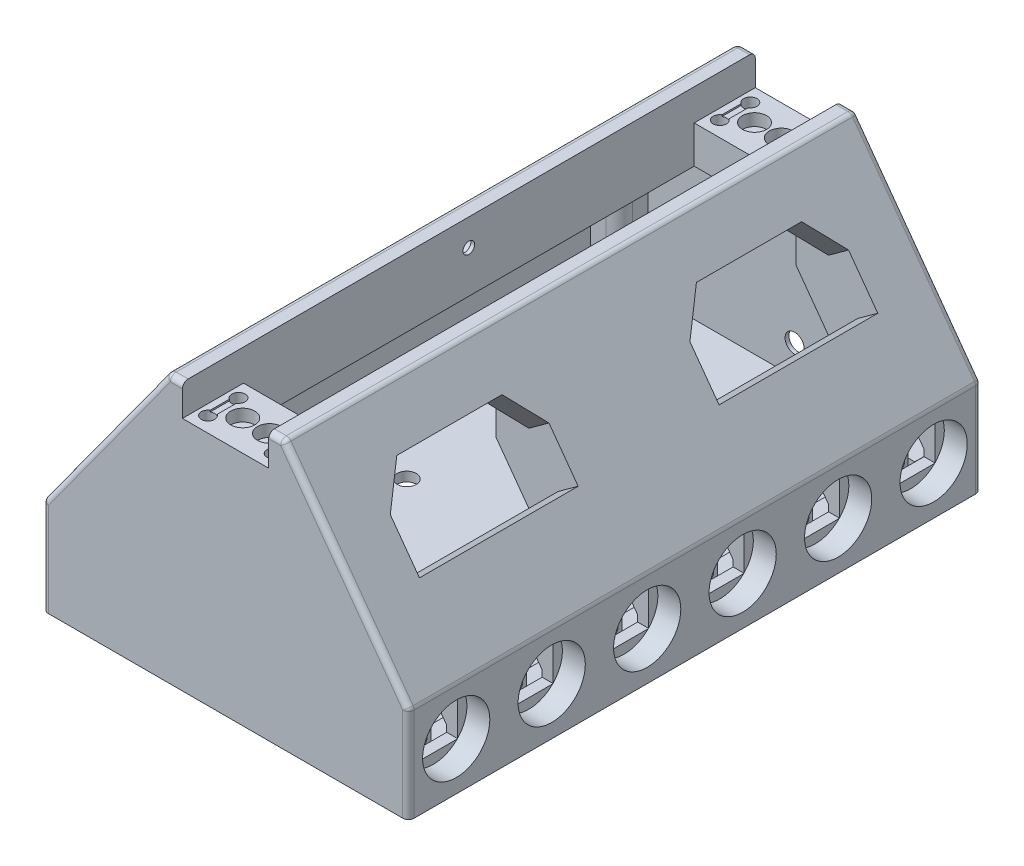
from build123d import *

# Parameters (mm, degrees)
BOSS_EXTRUDE2_DEPTH  = 150
CUT_EXTRUDE1_REACH   = 171.154
SKETCH3_R            = 1.75
SKETCH3_W            = 22.6
SKETCH3_H            = 118
BOSS_EXTRUDE4_DEPTH  = 150
SKETCH5_R            = 1.52
CUT_EXTRUDE2_DEPTH   = 176.795274739
CUT_EXTRUDE3_START   = 26.6
SKETCH6_R            = 1.52
CUT_EXTRUDE3_DEPTH   = 26.6
SKETCH7_R            = 2.8
CUT_EXTRUDE4_DEPTH   = 177.134515209
CUT_EXTRUDE5_REACH   = 181.704
SKETCH10_W           = 15.7
SKETCH10_H           = 29.5
CUT_EXTRUDE6_REACH   = 181.704
SKETCH11_W           = 41.55
SKETCH11_H           = 22
SKETCH13_W           = 10.694631307
SKETCH13_H           = 41.55
CUT_EXTRUDE7_DEPTH   = 12
SKETCH14_W           = 6.5
SKETCH14_H           = 7
BOSS_EXTRUDE5_DEPTH  = 9
SKETCH18_R           = 8.8
CUT_EXTRUDE8_DEPTH   = 6
CUT_EXTRUDE9_REACH   = 181.704
BOSS_EXTRUDE6_DEPTH  = 1
BOSS_EXTRUDE7_REACH  = 173.516
SKETCH27_R           = 2
CUT_EXTRUDE13_DEPTH  = 172.516398252
SKETCH29_R           = 2
CUT_EXTRUDE14_DEPTH  = 172.516398252
CUT_EXTRUDE_START    = -2.5
CUT_EXTRUDE_D_DEPTH  = 2.5
BOSS_EXTRUDE8_DEPTH  = 1.4
SKETCH33_R           = 2.5
CUT_EXTRUDE16_DEPTH  = 172.449336159
FILLET1_R            = 1.5
SKETCH34_R           = 3.15
CUT_EXTRUDE17_DEPTH  = 3.15
CUT_EXTRUDE18_REACH  = 190.314
SKETCH35_W           = 12.8
SKETCH35_H           = 12.35
SKETCH38_W           = 4.5
SKETCH38_H           = 14.045
BOSS_EXTRUDE10_DEPTH = 5
SKETCH39_R           = 1.25
CUT_EXTRUDE19_DEPTH  = 1.5
LPATTERN1_COUNT      = 6
LPATTERN1_PITCH      = 25
CUT_EXTRUDE20_DEPTH  = 0.4
BOSS_EXTRUDE12_START = 0.3
BOSS_EXTRUDE12_DEPTH = 5.5
BOSS_EXTRUDE13_DEPTH = 2.45
CUT_EXTRUDE22_START  = 0.05
SKETCH44_R           = 1.58
CUT_EXTRUDE22_DEPTH  = 2.45
SKETCH45_R           = 2.5
CUT_EXTRUDE23_DEPTH  = 2.45
BOSS_EXTRUDE14_DEPTH = 3.5


with BuildPart() as part:
    # Sketch1 → Boss-Extrude2 (new body)
    with BuildSketch(Plane.XY):
        Polygon((47.89441376, 0), (-47.89441376, 0), (-47.89441376, 25), (-15.2, 70), (-11.3, 70), (-11.3, 61.8), (11.3, 61.8), (11.3, 70), (15.2, 70), (47.89441376, 25), align=None)
        Polygon((45.89441376, 2), (-45.89441376, 2), (-45.89441376, 23.499509799), (-25.183315487, 52.005891016), (25.183315487, 52.005891016), (45.89441376, 23.499509799), align=None, mode=Mode.SUBTRACT)
    extrude(amount=BOSS_EXTRUDE2_DEPTH)

    # Sketch3 → Cut-Extrude1 (cut, up to next)
    with BuildSketch(Plane(origin=(0, 61.8, 0), x_dir=(1, 0, 0), z_dir=(0, 1, 0)), mode=Mode.PRIVATE) as cut_extrude1_sk1:
        with Locations(Location((-8.6, -12, 0), (0, 0, 270))):
            Circle(SKETCH3_R)
    cut_extrude1_tool1 = extrude(cut_extrude1_sk1.sketch, amount=-CUT_EXTRUDE1_REACH, mode=Mode.PRIVATE) & part.part
    # Sketch3 → Cut-Extrude1 (cut, up to next)
    with BuildSketch(Plane(origin=(0, 61.8, 0), x_dir=(1, 0, 0), z_dir=(0, 1, 0)), mode=Mode.PRIVATE) as cut_extrude1_sk2:
        with Locations(Location((-8.6, -4, 0), (0, 0, 270))):
            Circle(SKETCH3_R)
    cut_extrude1_tool2 = extrude(cut_extrude1_sk2.sketch, amount=-CUT_EXTRUDE1_REACH, mode=Mode.PRIVATE) & part.part
    # Sketch3 → Cut-Extrude1 (cut, up to next)
    with BuildSketch(Plane(origin=(0, 61.8, 0), x_dir=(1, 0, 0), z_dir=(0, 1, 0)), mode=Mode.PRIVATE) as cut_extrude1_sk3:
        with Locations(Location((8.6, -12, 0), (0, 0, 270))):
            Circle(SKETCH3_R)
    cut_extrude1_tool3 = extrude(cut_extrude1_sk3.sketch, amount=-CUT_EXTRUDE1_REACH, mode=Mode.PRIVATE) & part.part
    # Sketch3 → Cut-Extrude1 (cut, up to next)
    with BuildSketch(Plane(origin=(0, 61.8, 0), x_dir=(1, 0, 0), z_dir=(0, 1, 0)), mode=Mode.PRIVATE) as cut_extrude1_sk4:
        with Locations(Location((8.6, -4, 0), (0, 0, 270))):
            Circle(SKETCH3_R)
    cut_extrude1_tool4 = extrude(cut_extrude1_sk4.sketch, amount=-CUT_EXTRUDE1_REACH, mode=Mode.PRIVATE) & part.part
    # Sketch3 → Cut-Extrude1 (cut, up to next)
    with BuildSketch(Plane(origin=(0, 61.8, 0), x_dir=(1, 0, 0), z_dir=(0, 1, 0)), mode=Mode.PRIVATE) as cut_extrude1_sk5:
        with Locations(Location((8.6, -138, 0), (0, 0, 270))):
            Circle(SKETCH3_R)
    cut_extrude1_tool5 = extrude(cut_extrude1_sk5.sketch, amount=-CUT_EXTRUDE1_REACH, mode=Mode.PRIVATE) & part.part
    # Sketch3 → Cut-Extrude1 (cut, up to next)
    with BuildSketch(Plane(origin=(0, 61.8, 0), x_dir=(1, 0, 0), z_dir=(0, 1, 0)), mode=Mode.PRIVATE) as cut_extrude1_sk6:
        with Locations(Location((8.6, -146, 0), (0, 0, 270))):
            Circle(SKETCH3_R)
    cut_extrude1_tool6 = extrude(cut_extrude1_sk6.sketch, amount=-CUT_EXTRUDE1_REACH, mode=Mode.PRIVATE) & part.part
    # Sketch3 → Cut-Extrude1 (cut, up to next)
    with BuildSketch(Plane(origin=(0, 61.8, 0), x_dir=(1, 0, 0), z_dir=(0, 1, 0)), mode=Mode.PRIVATE) as cut_extrude1_sk7:
        with Locations(Location((-8.6, -146, 0), (0, 0, 270))):
            Circle(SKETCH3_R)
    cut_extrude1_tool7 = extrude(cut_extrude1_sk7.sketch, amount=-CUT_EXTRUDE1_REACH, mode=Mode.PRIVATE) & part.part
    # Sketch3 → Cut-Extrude1 (cut, up to next)
    with BuildSketch(Plane(origin=(0, 61.8, 0), x_dir=(1, 0, 0), z_dir=(0, 1, 0)), mode=Mode.PRIVATE) as cut_extrude1_sk8:
        with Locations(Location((-8.6, -138, 0), (0, 0, 270))):
            Circle(SKETCH3_R)
    cut_extrude1_tool8 = extrude(cut_extrude1_sk8.sketch, amount=-CUT_EXTRUDE1_REACH, mode=Mode.PRIVATE) & part.part
    # Sketch3 → Cut-Extrude1 (cut, up to next)
    with BuildSketch(Plane(origin=(0, 61.8, 0), x_dir=(1, 0, 0), z_dir=(0, 1, 0)), mode=Mode.PRIVATE) as cut_extrude1_sk9:
        with Locations((0, -75)):
            Rectangle(SKETCH3_W, SKETCH3_H)
    cut_extrude1_tool9 = extrude(cut_extrude1_sk9.sketch, amount=-CUT_EXTRUDE1_REACH, mode=Mode.PRIVATE) & part.part
    add(cut_extrude1_tool1.solids().sort_by_distance((-8.6, 61.8, 12))[0], mode=Mode.SUBTRACT)
    add(cut_extrude1_tool2.solids().sort_by_distance((-8.6, 61.8, 4))[0], mode=Mode.SUBTRACT)
    add(cut_extrude1_tool3.solids().sort_by_distance((8.6, 61.8, 12))[0], mode=Mode.SUBTRACT)
    add(cut_extrude1_tool4.solids().sort_by_distance((8.6, 61.8, 4))[0], mode=Mode.SUBTRACT)
    add(cut_extrude1_tool5.solids().sort_by_distance((8.6, 61.8, 138))[0], mode=Mode.SUBTRACT)
    add(cut_extrude1_tool6.solids().sort_by_distance((8.6, 61.8, 146))[0], mode=Mode.SUBTRACT)
    add(cut_extrude1_tool7.solids().sort_by_distance((-8.6, 61.8, 146))[0], mode=Mode.SUBTRACT)
    add(cut_extrude1_tool8.solids().sort_by_distance((-8.6, 61.8, 138))[0], mode=Mode.SUBTRACT)
    add(cut_extrude1_tool9.solids().sort_by_distance((0, 61.8, 75))[0], mode=Mode.SUBTRACT)

    # Sketch12 → Boss-Extrude4 (add)
    with BuildSketch(Plane(origin=(0, 0, 0), x_dir=(-1, 0, 0), z_dir=(0, 0, -1))):
        Polygon((-38.991903592, 8), (-14.3, 41.985489687), (-14.3, 52.005891016), (-25.183315487, 52.005891016), (-45.89441376, 23.499509799), (-45.89441376, 2), (-38.991903592, 2), align=None)
    extrude(amount=-BOSS_EXTRUDE4_DEPTH)

    # Sketch5 → Cut-Extrude2 (cut, through all)
    with BuildSketch(Plane(origin=(-11.3, 0, 0), x_dir=(0, 0, -1), z_dir=(1, 0, 0))):
        with Locations(Location((-75, 63, 0), (0, 0, 90))):
            Circle(SKETCH5_R)
    extrude(amount=-CUT_EXTRUDE2_DEPTH, mode=Mode.SUBTRACT)

    # Sketch6 → Cut-Extrude3 (cut)
    with BuildSketch(Plane(origin=(-11.3, 0, 0), x_dir=(0, 0, -1), z_dir=(1, 0, 0)).offset(CUT_EXTRUDE3_START)):
        with Locations(Location((-75, 63, 0), (0, 0, 90))):
            Circle(SKETCH6_R)
    extrude(amount=-CUT_EXTRUDE3_DEPTH, mode=Mode.SUBTRACT)

    # Sketch7 → Cut-Extrude4 (cut, through all)
    with BuildSketch(Plane(origin=(-12.3, 0, 0), x_dir=(0, 0, -1), z_dir=(1, 0, 0))):
        with Locations(Location((-75, 63, 0), (0, 0, 90))):
            Circle(SKETCH7_R)
    extrude(amount=-CUT_EXTRUDE4_DEPTH, mode=Mode.SUBTRACT)

    # Sketch10 → Cut-Extrude5 (cut, up to next)
    with BuildSketch(Plane(origin=(-43.235507228, 31.412434721, 0), x_dir=(0, 0, 1), z_dir=(-0.8090169943749446, 0.5877852522924771, 0)), mode=Mode.PRIVATE) as cut_extrude5_sk1:
        with Locations((75, 17.946853771)):
            Rectangle(SKETCH10_W, SKETCH10_H)
    cut_extrude5_tool1 = extrude(cut_extrude5_sk1.sketch, amount=-CUT_EXTRUDE5_REACH, mode=Mode.PRIVATE) & part.part
    add(cut_extrude5_tool1.solids().sort_by_distance((-32.686611, 45.931744, 75))[0], mode=Mode.SUBTRACT)

    # Sketch11 → Cut-Extrude6 (cut, up to next)
    with BuildSketch(Plane(origin=(43.235507228, 31.412434721, 0), x_dir=(0, 0, -1), z_dir=(0.8090169943749446, 0.5877852522924771, 0)), mode=Mode.PRIVATE) as cut_extrude6_sk1:
        with Locations((-114.225, 23.696853771)):
            Rectangle(SKETCH11_W, SKETCH11_H)
    cut_extrude6_tool1 = extrude(cut_extrude6_sk1.sketch, amount=-CUT_EXTRUDE6_REACH, mode=Mode.PRIVATE) & part.part
    cut_extrude6 = cut_extrude6_tool1.solids().sort_by_distance((29.306846, 50.583592, 114.225))[0]
    add(cut_extrude6, mode=Mode.SUBTRACT)

    # Sketch13 → Cut-Extrude7 (cut)
    with BuildSketch(Plane(origin=(-7.463023397, 10.271970476, 0), x_dir=(0.8090169943749446, 0.587785252292477, 0), z_dir=(-0.587785252292477, 0.8090169943749446, 0))):
        with Locations((41.594710322, -114.225)):
            Rectangle(SKETCH13_W, SKETCH13_H)
    cut_extrude7 = extrude(amount=-CUT_EXTRUDE7_DEPTH, mode=Mode.SUBTRACT)

    # Sketch14 → Boss-Extrude5 (add)
    with BuildSketch(Plane(origin=(-20.394298948, 28.070344352, 0), x_dir=(0.8090169943749446, 0.587785252292477, 0), z_dir=(0.587785252292477, -0.8090169943749446, 0))):
        with Locations((50.192025975, 96.95)):
            Rectangle(SKETCH14_W, SKETCH14_H)
        with Locations((50.192025975, 131.5)):
            Rectangle(SKETCH14_W, SKETCH14_H)
    boss_extrude5 = extrude(amount=BOSS_EXTRUDE5_DEPTH)

    # Sketch18 → Cut-Extrude8 (cut)
    with BuildSketch(Plane(origin=(47.89441376, 0, 0), x_dir=(0, 0, -1), z_dir=(1, 0, 0))):
        with Locations((-137.5, 12.5)):
            Circle(SKETCH18_R)
    cut_extrude8 = extrude(amount=-CUT_EXTRUDE8_DEPTH, mode=Mode.SUBTRACT)

    # Sketch19 → Cut-Extrude9 (cut, up to next)
    with BuildSketch(Plane(origin=(43.235507228, 31.412434721, 0), x_dir=(0, 0, -1), z_dir=(0.8090169943749448, 0.5877852522924768, 0)), mode=Mode.PRIVATE) as cut_extrude9_sk1:
        Polygon((-135, 25.696853771), (-128, 34.696853771), (-128, 25.696853771), align=None)
    cut_extrude9_tool1 = extrude(cut_extrude9_sk1.sketch, amount=-CUT_EXTRUDE9_REACH, mode=Mode.PRIVATE) & part.part
    # Sketch19 → Cut-Extrude9 (cut, up to next)
    with BuildSketch(Plane(origin=(43.235507228, 31.412434721, 0), x_dir=(0, 0, -1), z_dir=(0.8090169943749448, 0.5877852522924768, 0)), mode=Mode.PRIVATE) as cut_extrude9_sk2:
        Polygon((-100.45, 34.696853771), (-100.45, 25.696853771), (-93.45, 25.696853771), align=None)
    cut_extrude9_tool2 = extrude(cut_extrude9_sk2.sketch, amount=-CUT_EXTRUDE9_REACH, mode=Mode.PRIVATE) & part.part
    cut_extrude9_1 = cut_extrude9_tool1.solids().sort_by_distance((26.36792, 54.628677, 130.333333))[0]
    add(cut_extrude9_1, mode=Mode.SUBTRACT)
    cut_extrude9_2 = cut_extrude9_tool2.solids().sort_by_distance((26.36792, 54.628677, 98.116667))[0]
    add(cut_extrude9_2, mode=Mode.SUBTRACT)
    cut_extrude9 = cut_extrude9_1 + cut_extrude9_2  # Cut-Extrude9 as one shape, for the pattern or mirror that repeats it

    # Mirror1: Cut-Extrude6, Cut-Extrude7, Boss-Extrude5, Cut-Extrude9 across plane
    add(cut_extrude6.mirror(Plane.XY.offset(75)), mode=Mode.SUBTRACT)
    add(cut_extrude7.mirror(Plane.XY.offset(75)), mode=Mode.SUBTRACT)
    add(boss_extrude5.mirror(Plane.XY.offset(75)))
    add(cut_extrude9.mirror(Plane.XY.offset(75)), mode=Mode.SUBTRACT)

    # Sketch25 → Boss-Extrude6 (add)
    with BuildSketch(Plane.XY.offset(150)):
        Polygon((-11.3, 61.8), (-11.3, 70), (-15.2, 70), (-47.89441376, 25), (-47.89441376, 0), (47.89441376, 0), (47.89441376, 25), (15.2, 70), (11.3, 70), (11.3, 61.8), align=None)
    boss_extrude6 = extrude(amount=-BOSS_EXTRUDE6_DEPTH)

    # Mirror3: Boss-Extrude6 across plane
    add(boss_extrude6.mirror(Plane.XY.offset(75)))

    # Boss-Extrude7: up to this plane
    boss_extrude7_end = Plane(origin=(-41.212964742, 29.94297159, 150), z_dir=(-0.8090169943749446, 0.587785252292477, 0))
    # Sketch27 → Boss-Extrude7 (add, up to the surface)
    with BuildSketch(Plane(origin=(0, 2, 0), x_dir=(1, 0, 0), z_dir=(0, 1, 0)), mode=Mode.PRIVATE) as boss_extrude7_sk1:
        with BuildLine():
            Line((-41.89441376, -141.5), (-45.89441376, -141.5))
            Line((-45.89441376, -141.5), (-45.89441376, -149))
            Line((-45.89441376, -149), (-38.39441376, -149))
            Line((-38.39441376, -149), (-38.39441376, -145))
            ThreePointArc((-38.39441376, -145), (-39.419540026, -142.525126266), (-41.89441376, -141.5))
        make_face()
        with Locations(Location((-41.89441376, -145, 0), (0, 0, 180))):
            Circle(SKETCH27_R, mode=Mode.SUBTRACT)
    boss_extrude7_tool1 = split(extrude(boss_extrude7_sk1.sketch, amount=BOSS_EXTRUDE7_REACH, mode=Mode.PRIVATE), bisect_by=boss_extrude7_end, keep=Keep.BOTH, mode=Mode.PRIVATE)
    add(boss_extrude7_tool1.solids().sort_by_distance((-39.49454, 2, 142.600126))[0])
    # Sketch27 → Boss-Extrude7 (add, up to the surface)
    with BuildSketch(Plane(origin=(0, 2, 0), x_dir=(1, 0, 0), z_dir=(0, 1, 0)), mode=Mode.PRIVATE) as boss_extrude7_sk2:
        with BuildLine():
            Line((-45.89441376, -1), (-38.39441376, -1))
            Line((-38.39441376, -1), (-38.39441376, -5))
            ThreePointArc((-38.39441376, -5), (-39.419540026, -7.474873734), (-41.89441376, -8.5))
            Line((-41.89441376, -8.5), (-45.89441376, -8.5))
            Line((-45.89441376, -8.5), (-45.89441376, -1))
        make_face()
        with Locations(Location((-41.89441376, -5, 0), (0, 0, 90))):
            Circle(SKETCH27_R, mode=Mode.SUBTRACT)
    boss_extrude7_tool2 = split(extrude(boss_extrude7_sk2.sketch, amount=BOSS_EXTRUDE7_REACH, mode=Mode.PRIVATE), bisect_by=boss_extrude7_end, keep=Keep.BOTH, mode=Mode.PRIVATE)
    add(boss_extrude7_tool2.solids().sort_by_distance((-42.144414, 2, 1.106066))[0])

    # Sketch28 → Cut-Extrude13 (cut, through all)
    with BuildSketch(Plane(origin=(0, 2, 0), x_dir=(1, 0, 0), z_dir=(0, 1, 0))):
        with BuildLine():
            Line((38.991903592, -149), (38.991903592, -1))
            Line((38.991903592, -1), (-38.39441376, -1))
            Line((-38.39441376, -1), (-38.39441376, -5))
            ThreePointArc((-38.39441376, -5), (-39.419540026, -7.474873734), (-41.89441376, -8.5))
            Line((-41.89441376, -8.5), (-45.89441376, -8.5))
            Line((-45.89441376, -8.5), (-45.89441376, -141.5))
            Line((-45.89441376, -141.5), (-41.89441376, -141.5))
            ThreePointArc((-41.89441376, -141.5), (-39.419540026, -142.525126266), (-38.39441376, -145))
            Line((-38.39441376, -145), (-38.39441376, -149))
            Line((-38.39441376, -149), (38.991903592, -149))
        make_face()
    extrude(amount=-CUT_EXTRUDE13_DEPTH, mode=Mode.SUBTRACT)

    # Sketch29 → Cut-Extrude14 (cut, through all)
    with BuildSketch(Plane(origin=(0, 2, 0), x_dir=(1, 0, 0), z_dir=(0, 1, 0))):
        with Locations(Location((-41.89441376, -5, 0), (0, 0, 180))):
            Circle(SKETCH29_R)
        with Locations(Location((-41.89441376, -145, 0), (0, 0, 180))):
            Circle(SKETCH29_R)
    extrude(amount=-CUT_EXTRUDE14_DEPTH, mode=Mode.SUBTRACT)

    # Sketch30 → Cut-Extrude D (cut)
    with BuildSketch(Plane.XZ.offset(CUT_EXTRUDE_START)):
        with BuildLine():
            Line((-38.39441376, 149), (-45.89441376, 149))
            Line((-45.89441376, 149), (-45.89441376, 141.5))
            Line((-45.89441376, 141.5), (-41.89441376, 141.5))
            ThreePointArc((-41.89441376, 141.5), (-39.419540026, 142.525126266), (-38.39441376, 145))
            Line((-38.39441376, 145), (-38.39441376, 149))
        make_face()
        with BuildLine():
            Line((-45.89441376, 8.5), (-41.89441376, 8.5))
            ThreePointArc((-41.89441376, 8.5), (-39.419540026, 7.474873734), (-38.39441376, 5))
            Line((-38.39441376, 5), (-38.39441376, 1))
            Line((-38.39441376, 1), (-45.89441376, 1))
            Line((-45.89441376, 1), (-45.89441376, 8.5))
        make_face()
    extrude(amount=CUT_EXTRUDE_D_DEPTH, mode=Mode.SUBTRACT)

    # Sketch31 → Boss-Extrude8 (add)
    with BuildSketch(Plane(origin=(0, 0, 149), x_dir=(-1, 0, 0), z_dir=(0, 0, -1))):
        with BuildLine():
            Line((-38.991903592, 0), (-37.191903592, 0))
            Line((-37.191903592, 0), (-37.191903592, 2.6))
            ThreePointArc((-37.191903592, 2.6), (-37.30906088, 2.882842712), (-37.591903592, 3))
            Line((-37.591903592, 3), (-38.991903592, 3))
            Line((-38.991903592, 3), (-38.991903592, 0))
        make_face()
    boss_extrude8 = extrude(amount=BOSS_EXTRUDE8_DEPTH)

    # Mirror4: Boss-Extrude8 across plane
    add(boss_extrude8.mirror(Plane.XY.offset(75)))

    # Sketch33 → Cut-Extrude16 (cut, through all)
    with BuildSketch(Plane.XY.offset(1)):
        with Locations((0, 10)):
            Circle(SKETCH33_R)
    extrude(amount=-CUT_EXTRUDE16_DEPTH, mode=Mode.SUBTRACT)

    # Fillet1
    fillet1_edges = [part.edges().sort_by_distance(p)[0] for p in [
        (-13.25, 70, 0),
        (-31.54720688, 47.5, 0),
        (-47.89441376, 12.5, 0),
        (47.89441376, 12.5, 0),
        (31.54720688, 47.5, 0),
        (13.25, 70, 0),
        (13.25, 70, 150),
        (-15.2, 70, 75),
        (-47.89441376, 25, 75),
        (47.89441376, 25, 75),
        (15.2, 70, 75),
        (31.54720688, 47.5, 150),
        (47.89441376, 12.5, 150),
        (-47.89441376, 12.5, 150),
        (-31.54720688, 47.5, 150),
        (-13.25, 70, 150),
    ]]
    fillet(fillet1_edges, radius=FILLET1_R)

    # Sketch34 → Cut-Extrude17 (cut)
    with BuildSketch(Plane(origin=(0, 61.8, 0), x_dir=(1, 0, 0), z_dir=(0, 1, 0))):
        with Locations(Location((-3.5, -8, 0), (0, 0, 270))):
            Circle(SKETCH34_R)
        with Locations(Location((3.5, -8, 0), (0, 0, 270))):
            Circle(SKETCH34_R)
    cut_extrude17 = extrude(amount=-CUT_EXTRUDE17_DEPTH, mode=Mode.SUBTRACT)

    # Mirror6: Cut-Extrude17 across plane
    add(cut_extrude17.mirror(Plane.XY.offset(75)), mode=Mode.SUBTRACT)

    # Sketch35 → Cut-Extrude18 (cut, up to next)
    with BuildSketch(Plane(origin=(41.89441376, 0, 0), x_dir=(0, 0, -1), z_dir=(1, 0, 0)), mode=Mode.PRIVATE) as cut_extrude18_sk1:
        with Locations((-137.5, 12.5)):
            Rectangle(SKETCH35_W, SKETCH35_H)
    cut_extrude18_tool1 = extrude(cut_extrude18_sk1.sketch, amount=-CUT_EXTRUDE18_REACH, mode=Mode.PRIVATE) & part.part
    cut_extrude18 = cut_extrude18_tool1.solids().sort_by_distance((41.894414, 12.5, 137.5))[0]
    add(cut_extrude18, mode=Mode.SUBTRACT)

    # Sketch38 → Boss-Extrude10 (add)
    with BuildSketch(Plane.ZY.offset(-38.991903592)):
        with Locations((137.5, 11.6525)):
            Rectangle(SKETCH38_W, SKETCH38_H)
    boss_extrude10 = extrude(amount=BOSS_EXTRUDE10_DEPTH)

    # Sketch39 → Cut-Extrude19 (cut)
    with BuildSketch(Plane(origin=(38.991903592, 0, 0), x_dir=(0, 0, -1), z_dir=(1, 0, 0))):
        with Locations((-137.5, 17.425)):
            Circle(SKETCH39_R)
        with Locations(Location((-137.5, 7.575, 0), (0, 0, 270))):
            Circle(SKETCH39_R)
    cut_extrude19 = extrude(amount=-CUT_EXTRUDE19_DEPTH, mode=Mode.SUBTRACT)

    # LPattern1: Cut-Extrude8, Cut-Extrude18, Boss-Extrude10, Cut-Extrude19 ×6
    with Locations(*[(0, 0, -i * LPATTERN1_PITCH) for i in range(1, LPATTERN1_COUNT)]):
        add(cut_extrude8, mode=Mode.SUBTRACT)
        add(cut_extrude18, mode=Mode.SUBTRACT)
        add(boss_extrude10)
        add(cut_extrude19, mode=Mode.SUBTRACT)

    # Sketch40 → Cut-Extrude20 (cut)
    with BuildSketch(Plane(origin=(0, 61.8, 0), x_dir=(1, 0, 0), z_dir=(0, 1, 0))):
        with BuildLine():
            Line((7.676241244, -5.486327609), (7.676241244, -10.513672391))
            ThreePointArc((7.676241244, -10.513672391), (8.6, -10.25), (9.523758756, -10.513672391))
            Line((9.523758756, -10.513672391), (9.523758756, -5.486327609))
            ThreePointArc((9.523758756, -5.486327609), (8.6, -5.75), (7.676241244, -5.486327609))
        make_face()
        with BuildLine():
            Line((-9.523758756, -5.486327609), (-9.523758756, -10.513672391))
            ThreePointArc((-9.523758756, -10.513672391), (-8.6, -10.25), (-7.676241244, -10.513672391))
            Line((-7.676241244, -10.513672391), (-7.676241244, -5.486327609))
            ThreePointArc((-7.676241244, -5.486327609), (-8.6, -5.75), (-9.523758756, -5.486327609))
        make_face()
        with BuildLine():
            Line((-7.676241244, -144.513672391), (-7.676241244, -139.486327609))
            ThreePointArc((-7.676241244, -139.486327609), (-8.6, -139.75), (-9.523758756, -139.486327609))
            Line((-9.523758756, -139.486327609), (-9.523758756, -144.513672391))
            ThreePointArc((-9.523758756, -144.513672391), (-8.6, -144.25), (-7.676241244, -144.513672391))
        make_face()
        with BuildLine():
            Line((9.523758756, -144.513672391), (9.523758756, -139.486327609))
            ThreePointArc((9.523758756, -139.486327609), (8.6, -139.75), (7.676241244, -139.486327609))
            Line((7.676241244, -139.486327609), (7.676241244, -144.513672391))
            ThreePointArc((7.676241244, -144.513672391), (8.6, -144.25), (9.523758756, -144.513672391))
        make_face()
    extrude(amount=-CUT_EXTRUDE20_DEPTH, mode=Mode.SUBTRACT)


with BuildPart() as body_2:
    # Sketch42 → Boss-Extrude12 (new body)
    with BuildSketch(Plane.ZY.offset(-38.991903592).offset(BOSS_EXTRUDE12_START)):
        Polygon((148.85, 3.08), (147.45, 3.08), (147.45, 0), (2.55, 0), (2.55, 3.08), (1.15, 3.08), (1.15, 6.08), (8.25, 6.08), (8.25, 4.33), (141.75, 4.33), (141.75, 6.08), (148.85, 6.08), align=None)
    extrude(amount=BOSS_EXTRUDE12_DEPTH)

    # Sketch41 → Boss-Extrude13 (add)
    with BuildSketch(Plane.XZ):
        Polygon((-45.79441376, 1.2), (36.991903592, 1.2), (36.991903592, 2.55), (33.191903592, 2.55), (33.191903592, 147.45), (36.991903592, 147.45), (36.991903592, 148.8), (-45.79441376, 148.8), align=None)
    extrude(amount=-BOSS_EXTRUDE13_DEPTH)

    # Sketch44 → Cut-Extrude22 (cut)
    with BuildSketch(Plane(origin=(0, 2.5, 0), x_dir=(-1, 0, 0), z_dir=(0, -1, 0)).offset(CUT_EXTRUDE22_START)):
        with Locations(Location((41.89441376, -5, 0), (0, 0, 270))):
            Circle(SKETCH44_R)
        with Locations(Location((41.89441376, -145, 0), (0, 0, 270))):
            Circle(SKETCH44_R)
    extrude(amount=CUT_EXTRUDE22_DEPTH, mode=Mode.SUBTRACT)

    # Sketch45 → Cut-Extrude23 (cut)
    with BuildSketch(Plane.XZ):
        with Locations(Location((-27.557915691, 75, 0), (0, 0, 270))):
            Circle(SKETCH45_R)
    extrude(amount=-CUT_EXTRUDE23_DEPTH, mode=Mode.SUBTRACT)


with BuildPart() as body_3:
    # Sketch47 → Boss-Extrude14 (new body)
    with BuildSketch(Plane.XZ):
        with BuildLine():
            Line((-37.79441376, 7.854057574), (-42.79441376, 7.854057574))
            ThreePointArc((-42.79441376, 7.854057574), (-44.79441376, 9.854057574), (-42.79441376, 11.854057574))
            Line((-42.79441376, 11.854057574), (-37.79441376, 11.854057574))
            ThreePointArc((-37.79441376, 11.854057574), (-35.79441376, 9.854057574), (-37.79441376, 7.854057574))
        make_face()
    extrude(amount=BOSS_EXTRUDE14_DEPTH)


solid = Compound([part.part, body_2.part, body_3.part])
